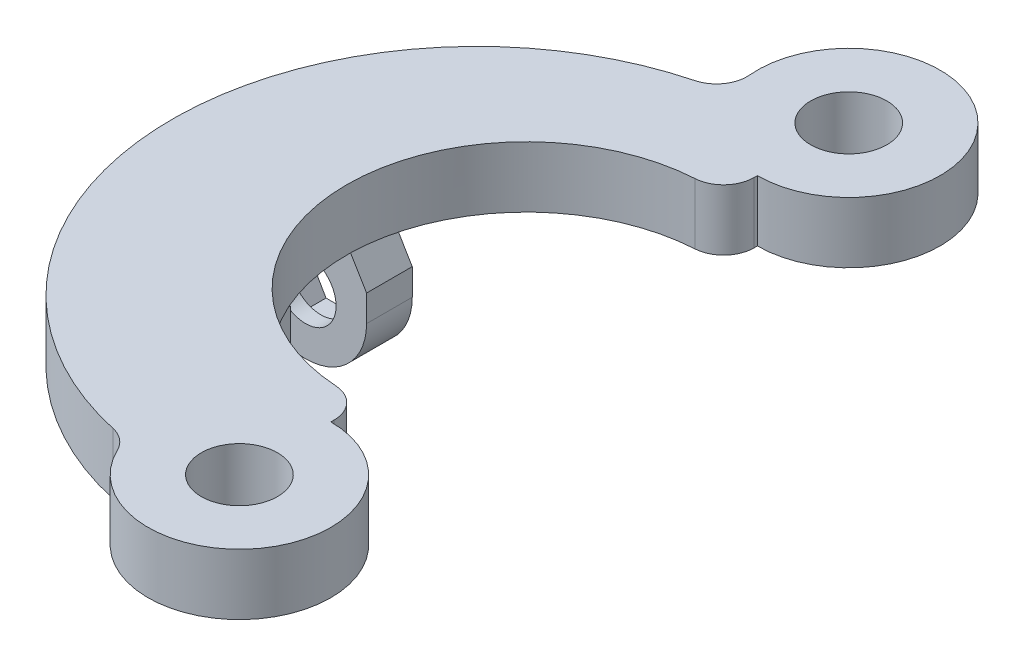
from build123d import *

# Parameters (mm, degrees)
BOSS_EXTRUDE1_DEPTH          = 4
BOSS_EXTRUDE2_DEPTH          = 3
BOSS_EXTRUDE3_DEPTH          = 3
CUT_EXTRUDE1_DEPTH           = 2
F_5_0_5_DIAMETER_HOLE1_D     = 5
F_5_0_5_DIAMETER_HOLE1_DEPTH = 11.5
SKETCH7_W                    = 2
SKETCH7_H                    = 21.25889
M20_CLEARANCE_HOLE1_D        = 23.618330199
M20_CLEARANCE_HOLE1_DEPTH    = 4
F_4_0_4_DIAMETER_HOLE2_D     = 4
F_4_0_4_DIAMETER_HOLE2_DEPTH = 27.25889
FILLET1_R                    = 2


with BuildPart() as part:
    # Sketch1 → Boss-Extrude1 (new body)
    with BuildSketch(Plane(origin=(0, 5.770898059, 0), x_dir=(1, 0, 0), z_dir=(0, 1, 0))):
        with BuildLine():
            Line((7, -23.75889), (7, 4.24111))
            ThreePointArc((7, 4.24111), (10.353454391, 15.21648372), (1.438437052, 7.989662117))
            ThreePointArc((1.438437052, 7.989662117), (-15.414893863, -11.667157982), (1.252670952, -31.481739039))
            ThreePointArc((1.252670952, -31.481739039), (11.8133717, -33.340991741), (7, -23.75889))
        make_face()
    extrude(amount=-BOSS_EXTRUDE1_DEPTH)

    # Sketch2 → Boss-Extrude2 (add)
    with BuildSketch(Plane.XY.offset(17.5)):
        with BuildLine():
            Line((-4.913051605, -1.660534859), (-4.913051605, 1.770898059))
            Line((-4.913051605, 1.770898059), (-12.913051605, 1.770898059))
            Line((-12.913051605, 1.770898059), (-12.913051605, -1.660534859))
            ThreePointArc((-12.913051605, -1.660534859), (-8.913051605, -5.660534859), (-4.913051605, -1.660534859))
        make_face()
    extrude(amount=-BOSS_EXTRUDE2_DEPTH)

    # Sketch3 → Boss-Extrude3 (add)
    with BuildSketch(Plane.XY.offset(9.5)):
        with BuildLine():
            Line((-4.913051605, -1.729101941), (-4.913051605, 0.01125604))
            Line((-4.913051605, 0.01125604), (-5.962229818, 1.770898059))
            Line((-5.962229818, 1.770898059), (-12.913051605, 1.770898059))
            Line((-12.913051605, 1.770898059), (-12.913051605, -1.729101941))
            ThreePointArc((-12.913051605, -1.729101941), (-8.913051605, -5.729101941), (-4.913051605, -1.729101941))
        make_face()
    extrude(amount=-BOSS_EXTRUDE3_DEPTH)

    # Sketch4 → Cut-Extrude1 (cut)
    with BuildSketch(Plane(origin=(0, 0, 6.5), x_dir=(-1, 0, 0), z_dir=(0, 0, -1))):
        Polygon((7.253169581, 1.145898059), (5.593287557, -1.729101941), (7.253169581, -4.604101941), (10.572933629, -4.604101941), (12.232815653, -1.729101941), (10.572933629, 1.145898059), align=None)
    extrude(amount=-CUT_EXTRUDE1_DEPTH, mode=Mode.SUBTRACT)

    # Ø5.0 (5) Diameter Hole1
    with Locations(Plane(origin=(0, 5.770898059, 0), x_dir=(1, 0, 0), z_dir=(0, 1, 0))):
        with Locations((7, -29.75889), (7, 10.24111)):
            Hole(F_5_0_5_DIAMETER_HOLE1_D / 2, depth=F_5_0_5_DIAMETER_HOLE1_DEPTH)

    # Sketch7 → Ø4.0 (4) Diameter Hole1 (revolve, cut)
    with BuildSketch(Plane(origin=(-8.913051605, -1.729101941, 14.5), x_dir=(0, 1, 0), z_dir=(1, 0, 0))):
        with Locations((1, 10.629445)):
            Rectangle(SKETCH7_W, SKETCH7_H)
    revolve(axis=Axis((-8.913051605, -1.729101941, 8.15), (0, 0, 1)), mode=Mode.SUBTRACT)

    # M20 Clearance Hole1
    with Locations(Plane(origin=(0, 5.770898059, 0), x_dir=(1, 0, 0), z_dir=(0, 1, 0))):
        with Locations((5.844097137, -9.75889)):
            Hole(M20_CLEARANCE_HOLE1_D / 2, depth=M20_CLEARANCE_HOLE1_DEPTH)

    # Ø4.0 (4) Diameter Hole2
    with Locations(Plane(origin=(0, 0, 8.5), x_dir=(-1, 0, 0), z_dir=(0, 0, -1))):
        with Locations((8.913051605, -1.729101941)):
            Hole(F_4_0_4_DIAMETER_HOLE2_D / 2, depth=F_4_0_4_DIAMETER_HOLE2_DEPTH)

    # Fillet1
    fillet1_edges = [part.edges().sort_by_distance(p)[0] for p in [
        (1.438437052, 3.770898059, -7.989662117),
        (1.252670952, 3.770898059, 31.481739039),
        (7, 3.770898059, -1.993567995),
        (7, 3.770898059, 21.511347995),
    ]]
    fillet(fillet1_edges, radius=FILLET1_R)


solid = part.part
